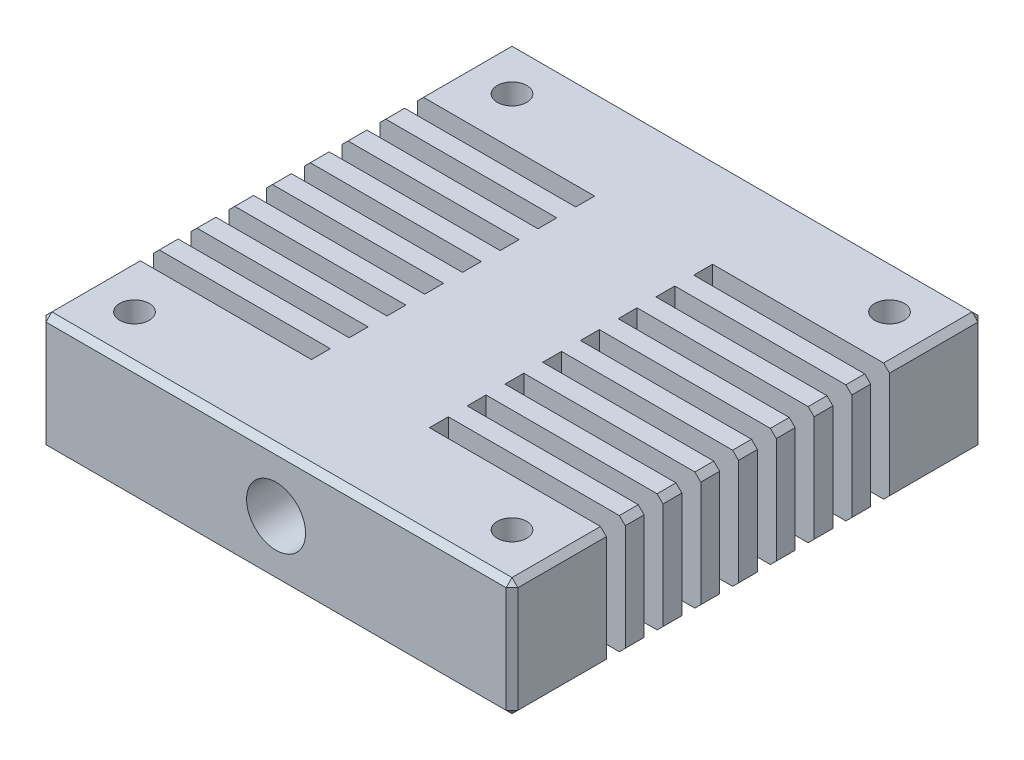
from build123d import *

# Parameters (mm, degrees)
ESQUISSE2_W                                   = 40
ESQUISSE2_H                                   = 10
BOSS_EXTRU_1_DEPTH                            = 40
DIAM_TRE_DU_PER_AGE_4_1_4_1_1_D               = 4.1
TROU_POUR_TARAUDAGE_POUR_TROU_TARAUD_M6_D     = 5
TROU_POUR_TARAUDAGE_POUR_TROU_TARAUD_M6_DEPTH = 8
TROU_POUR_TARAUDAGE_POUR_TROU_TARAUD_M6_TIP   = 1.502151548
DIAM_TRE_DU_PER_AGE_6_0_6_1_D                 = 6
DIAM_TRE_DU_PER_AGE_6_0_6_1_DEPTH             = 20
DIAM_TRE_DU_PER_AGE_6_0_6_1_TIP               = 1.802581857
TROU_POUR_TARAUDAGE_POUR_TROU_TARAUD_M3_D     = 2.5
TROU_POUR_TARAUDAGE_POUR_TROU_TARAUD_2_D      = 2.5
TROU_POUR_TARAUDAGE_POUR_TROU_TARAUD_2_DEPTH  = 5
TROU_POUR_TARAUDAGE_POUR_TROU_TARAUD_2_TIP    = 0.751075774
CHANFREIN1_SIZE                               = 0.5
ESQUISSE20_W                                  = 15
ESQUISSE20_H                                  = 1.6
ENL_V_MAT_EXTRU_1_DEPTH                       = 58.445626465
R_P_TITION_LIN_AIRE1_COUNT                    = 8
R_P_TITION_LIN_AIRE1_PITCH                    = 3.2


with BuildPart() as part:
    # Esquisse2 → Boss.-Extru.1 (new body)
    with BuildSketch(Plane.XY):
        with Locations((20, 5)):
            Rectangle(ESQUISSE2_W, ESQUISSE2_H)
    extrude(amount=BOSS_EXTRU_1_DEPTH)

    # Diamètre du perçage Ø4.1 (4.1)1 (through all)
    with Locations(Plane.XY.offset(40)):
        with Locations((20, 5)):
            Hole(DIAM_TRE_DU_PER_AGE_4_1_4_1_1_D / 2)

    # Trou pour taraudage pour trou taraudé M61
    with Locations(Plane.XY.offset(40)):
        with Locations((20, 5)):
            Hole(TROU_POUR_TARAUDAGE_POUR_TROU_TARAUD_M6_D / 2, depth=TROU_POUR_TARAUDAGE_POUR_TROU_TARAUD_M6_DEPTH)
            with Locations((0, 0, -(TROU_POUR_TARAUDAGE_POUR_TROU_TARAUD_M6_DEPTH + TROU_POUR_TARAUDAGE_POUR_TROU_TARAUD_M6_TIP / 2))):  # 118° drill point
                Cone(0, TROU_POUR_TARAUDAGE_POUR_TROU_TARAUD_M6_D / 2, TROU_POUR_TARAUDAGE_POUR_TROU_TARAUD_M6_TIP, mode=Mode.SUBTRACT)

    # Diamètre du perçage Ø6.0 (6)1
    with Locations(Plane(origin=(0, 0, 0), x_dir=(-1, 0, 0), z_dir=(0, 0, -1))):
        with Locations((-20, 5)):
            Hole(DIAM_TRE_DU_PER_AGE_6_0_6_1_D / 2, depth=DIAM_TRE_DU_PER_AGE_6_0_6_1_DEPTH)
            with Locations((0, 0, -(DIAM_TRE_DU_PER_AGE_6_0_6_1_DEPTH + DIAM_TRE_DU_PER_AGE_6_0_6_1_TIP / 2))):  # 118° drill point
                Cone(0, DIAM_TRE_DU_PER_AGE_6_0_6_1_D / 2, DIAM_TRE_DU_PER_AGE_6_0_6_1_TIP, mode=Mode.SUBTRACT)

    # Trou pour taraudage pour trou taraud_ M3 (through all)
    with Locations(Plane(origin=(0, 0, 0), x_dir=(-1, 0, 0), z_dir=(0, -1, 0))):
        with Locations((-4, -36), (-36, -36), (-36, -4), (-4, -4)):
            Hole(TROU_POUR_TARAUDAGE_POUR_TROU_TARAUD_M3_D / 2)

    # Trou pour taraudage pour trou taraud 2
    with Locations(Plane(origin=(0, 0, 0), x_dir=(-1, 0, 0), z_dir=(0, -1, 0))):
        with Locations((-20, -4)):
            Hole(TROU_POUR_TARAUDAGE_POUR_TROU_TARAUD_2_D / 2, depth=TROU_POUR_TARAUDAGE_POUR_TROU_TARAUD_2_DEPTH)
            with Locations((0, 0, -(TROU_POUR_TARAUDAGE_POUR_TROU_TARAUD_2_DEPTH + TROU_POUR_TARAUDAGE_POUR_TROU_TARAUD_2_TIP / 2))):  # 118° drill point
                Cone(0, TROU_POUR_TARAUDAGE_POUR_TROU_TARAUD_2_D / 2, TROU_POUR_TARAUDAGE_POUR_TROU_TARAUD_2_TIP, mode=Mode.SUBTRACT)

    # Chanfrein1
    chanfrein1_edges = [part.edges().sort_by_distance(p)[0] for p in [
        (40, 5, 40),
        (20, 10, 40),
        (0, 5, 40),
        (20, 10, 0),
        (40, 5, 0),
        (20, 0, 0),
        (0, 5, 0),
        (20, 0, 40),
        (0, 10, 20),
        (40, 10, 20),
        (40, 0, 20),
        (0, 0, 20),
    ]]
    chamfer(chanfrein1_edges, length=CHANFREIN1_SIZE)

    # Esquisse20 → Enlèv. mat.-Extru.1 (cut, through all)
    with BuildSketch(Plane(origin=(0, 0, 0), x_dir=(-1, 0, 0), z_dir=(0, -1, 0))):
        with Locations((-7.5, -31.2)):
            Rectangle(ESQUISSE20_W, ESQUISSE20_H)
        with Locations((-32.5, -31.2)):
            Rectangle(ESQUISSE20_W, ESQUISSE20_H)
    enl_v_mat_extru_1 = extrude(amount=-ENL_V_MAT_EXTRU_1_DEPTH, mode=Mode.SUBTRACT)

    # Répétition linéaire1: Enlèv. mat.-Extru.1 ×8
    with Locations(*[(0, 0, -i * R_P_TITION_LIN_AIRE1_PITCH) for i in range(1, R_P_TITION_LIN_AIRE1_COUNT)]):
        add(enl_v_mat_extru_1, mode=Mode.SUBTRACT)


solid = part.part
